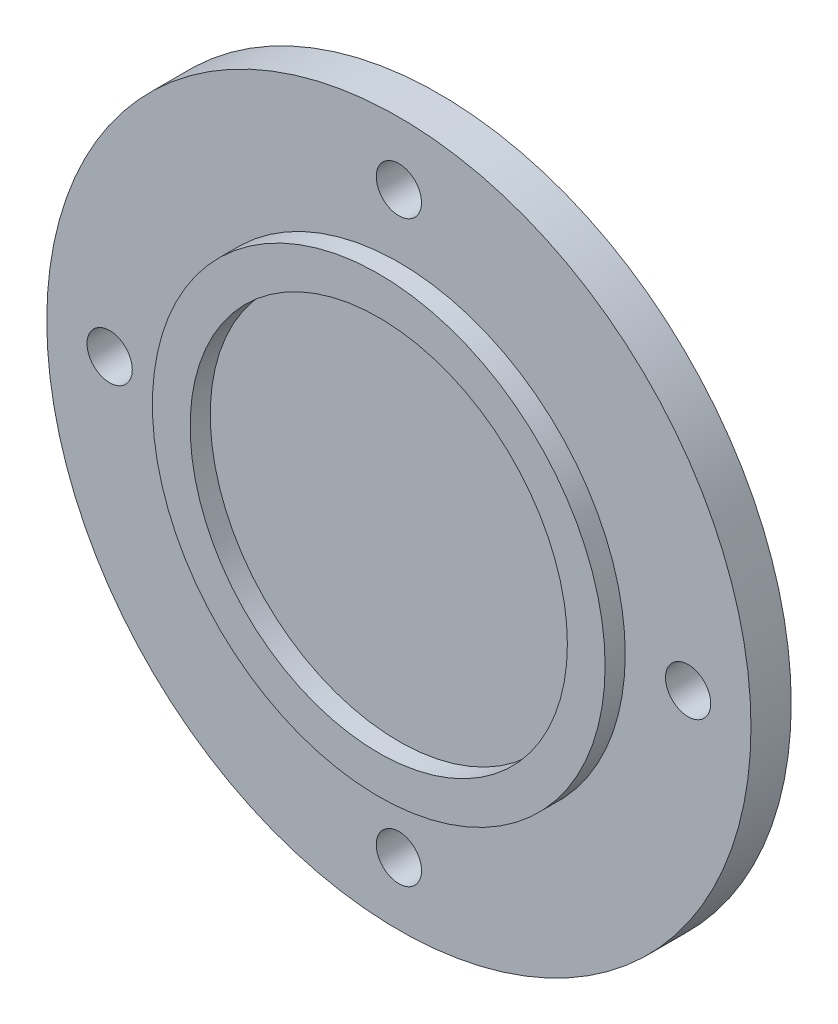
from build123d import *

# Parameters (mm, degrees)
SKETCH1_R           = 70
SKETCH1_R_2         = 4.5
BOSS_EXTRUDE1_DEPTH = 12
CUT_EXTRUDE1_START  = -4
SKETCH2_R           = 70
SKETCH2_R_2         = 45
CUT_EXTRUDE1_DEPTH  = 4
SKETCH3_R           = 37.5
CUT_EXTRUDE2_DEPTH  = 4


with BuildPart() as part:
    # Sketch1 → Boss-Extrude1 (new body)
    with BuildSketch(Plane.XY):
        Circle(SKETCH1_R)
        with Locations((0, 57.5)):
            Circle(SKETCH1_R_2, mode=Mode.SUBTRACT)
        with Locations((57.5, 0)):
            Circle(SKETCH1_R_2, mode=Mode.SUBTRACT)
        with Locations((0, -57.5)):
            Circle(SKETCH1_R_2, mode=Mode.SUBTRACT)
        with Locations((-57.5, 0)):
            Circle(SKETCH1_R_2, mode=Mode.SUBTRACT)
    extrude(amount=BOSS_EXTRUDE1_DEPTH)

    # Sketch2 → Cut-Extrude1 (cut)
    with BuildSketch(Plane.XY.offset(12).offset(CUT_EXTRUDE1_START)):
        Circle(SKETCH2_R)
        Circle(SKETCH2_R_2, mode=Mode.SUBTRACT)
    extrude(amount=CUT_EXTRUDE1_DEPTH, mode=Mode.SUBTRACT)

    # Sketch3 → Cut-Extrude2 (cut)
    with BuildSketch(Plane.XY.offset(12)):
        Circle(SKETCH3_R)
    extrude(amount=-CUT_EXTRUDE2_DEPTH, mode=Mode.SUBTRACT)


solid = part.part
